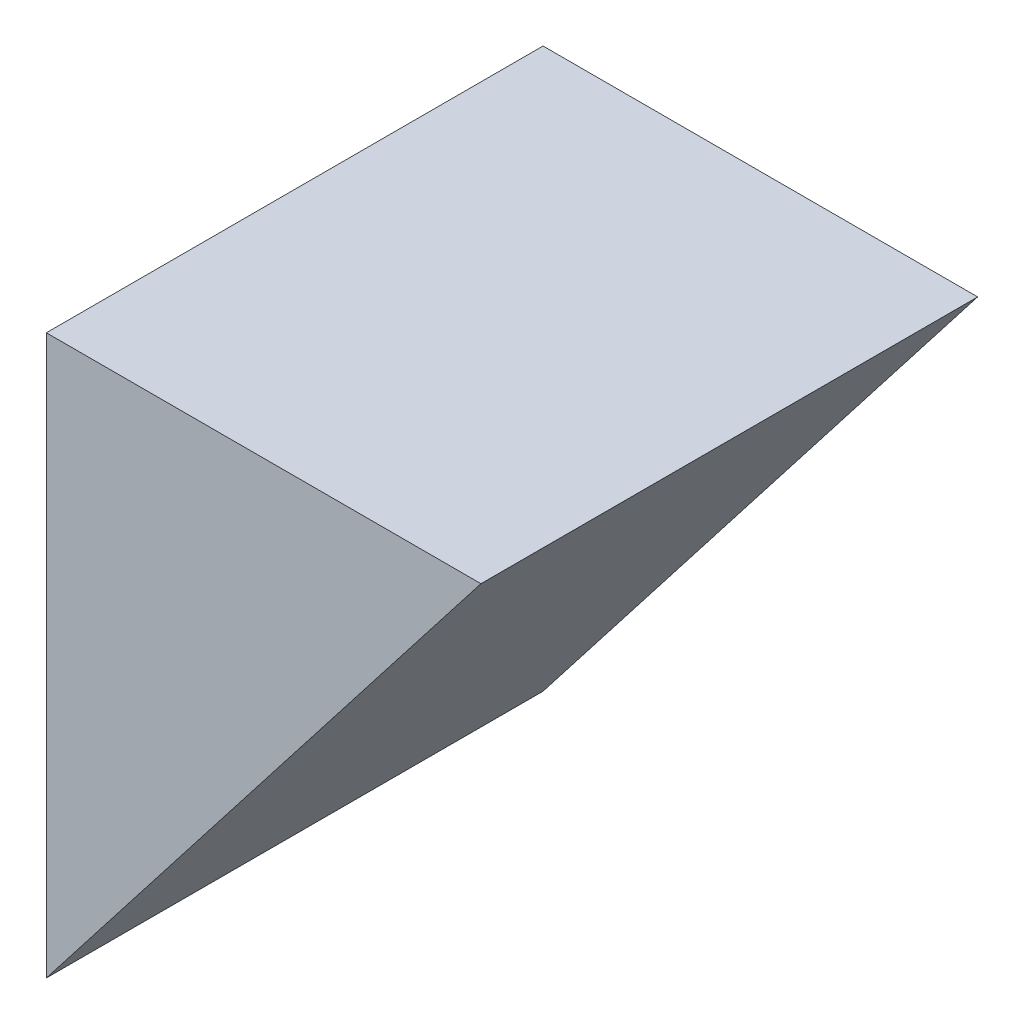
from build123d import *

# Parameters (mm, degrees)
BOSS_EXTRUDE1_DEPTH = 4


with BuildPart() as part:
    # Sketch1 → Boss-Extrude1 (new, symmetric)
    with BuildSketch(Plane.XY.offset(-20)):
        Polygon((-8.577275623, -13.148147109), (-8.577275623, -22.148147109), (-1.577275623, -13.148147109), align=None)
    extrude(amount=BOSS_EXTRUDE1_DEPTH, both=True)


solid = part.part
